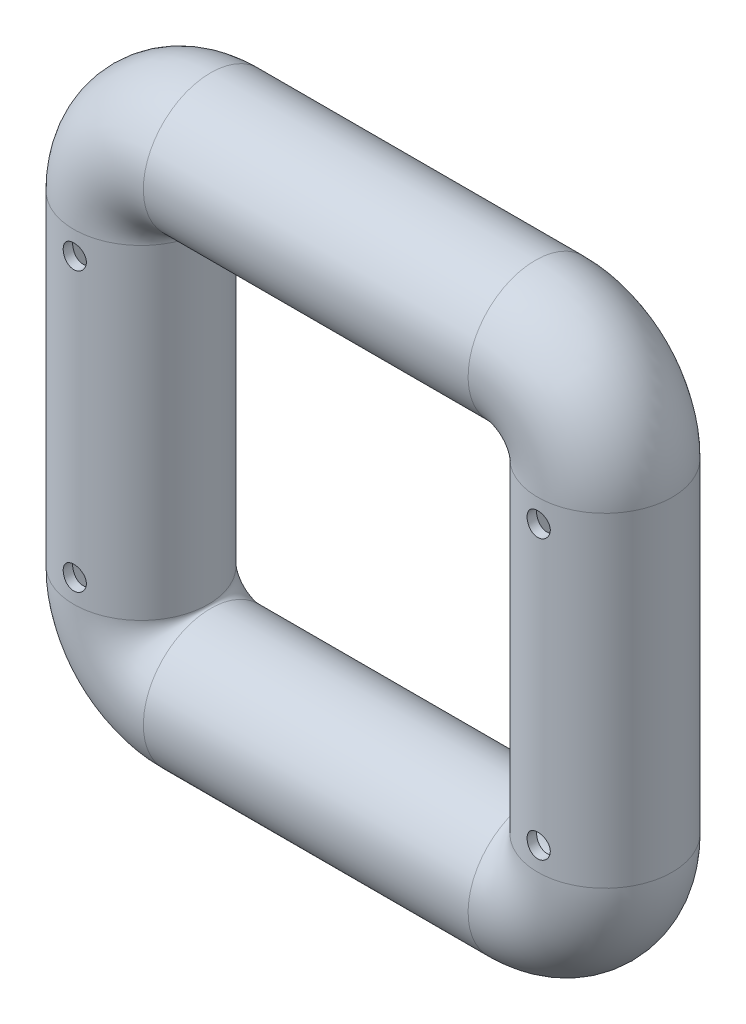
from build123d import *

# Parameters (mm, degrees)
BALAYAGE_MINCE1_PROFILE_R    = 14.5
BALAYAGE_MINCE1_PROFILE_R_2  = 12.5
ENL_V_MAT_EXTRU_1_DEPTH      = 93.362059465
ENL_V_MAT_EXTRU_1_DEPTH_BACK = 93.362059465
ESQUISSE24_R                 = 2.5


with BuildPart() as part:
    # Balayage-Mince1: sweep along a path in Esquisse1
    with BuildLine(Plane.XY) as balayage_mince1_path:
        Line((-35, 50), (35, 50))
        ThreePointArc((35, 50), (45.606601718, 45.606601718), (50, 35))
        Line((50, 35), (50, -35))
        ThreePointArc((50, -35), (45.606601718, -45.606601718), (35, -50))
        Line((35, -50), (-35, -50))
        ThreePointArc((-35, -50), (-45.606601718, -45.606601718), (-50, -35))
        Line((-50, -35), (-50, 35))
        ThreePointArc((-50, 35), (-45.606601718, 45.606601718), (-35, 50))
    # Balayage-Mince1 profile (on start of the path) → Balayage-Mince1 (sweep)
    with BuildSketch(Plane(origin=(-35, 50, 0), x_dir=(0, 0, 1), z_dir=(1, 0, 0))):
        Circle(BALAYAGE_MINCE1_PROFILE_R)
        Circle(BALAYAGE_MINCE1_PROFILE_R_2, mode=Mode.SUBTRACT)
    sweep(path=balayage_mince1_path.line)

    # Esquisse24 → Enlèv. mat.-Extru.1 (cut, two sides: drawn at the far end of the back side and taken through both)
    with BuildSketch(Plane.XY.offset(-ENL_V_MAT_EXTRU_1_DEPTH_BACK)):
        with Locations((-50, 30)):
            Circle(ESQUISSE24_R)
        with Locations((-50, -30)):
            Circle(ESQUISSE24_R)
        with Locations((50, 30)):
            Circle(ESQUISSE24_R)
        with Locations((50, -30)):
            Circle(ESQUISSE24_R)
    extrude(amount=ENL_V_MAT_EXTRU_1_DEPTH + ENL_V_MAT_EXTRU_1_DEPTH_BACK, mode=Mode.SUBTRACT)


solid = part.part
